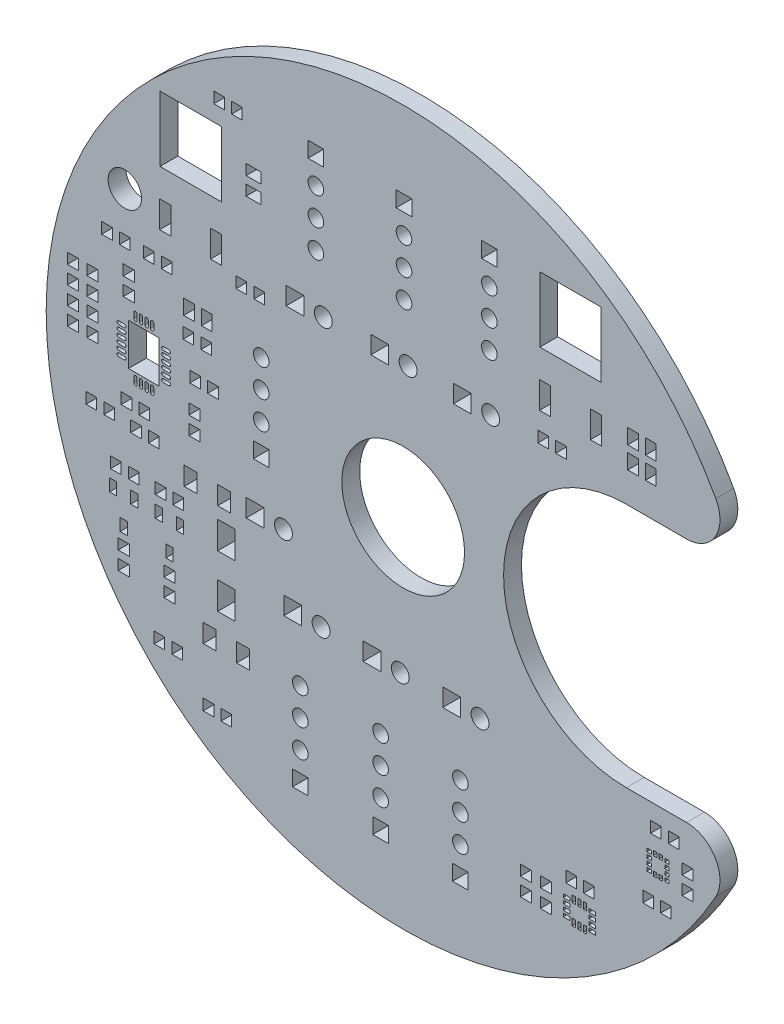
from build123d import *

# Parameters (mm, degrees)
MODEL_R            = 1.5
MODEL_R_2          = 0.7
MODEL_R_3          = 0.8
MODEL_R_4          = 5.500002467
MODEL_W            = 0.4
MODEL_H            = 0.3
MODEL_W_2          = 0.3
MODEL_H_2          = 0.4
MODEL_W_3          = 0.6
MODEL_H_3          = 0.6
MODEL_W_4          = 0.95
MODEL_H_4          = 1.35
MODEL_W_5          = 2.75
MODEL_H_5          = 3.75
MODEL_W_6          = 0.65
MODEL_H_6          = 1.1
MODEL_W_7          = 1.35
MODEL_H_7          = 0.95
MODEL_W_8          = 1
MODEL_H_8          = 2.4
MODEL_W_9          = 5.5
MODEL_H_9          = 5.85
MODEL_H_10         = 1
MODEL_W_10         = 1.15
MODEL_H_11         = 1.65
MODEL_W_11         = 1.55
MODEL_H_12         = 2.45
MODEL_W_12         = 1.4
MODEL_H_13         = 1.4
MODEL_W_13         = 1.6
MODEL_H_14         = 1.6
BOSS_EXTRU_1_DEPTH = 1.6


with BuildPart() as part:
    # Model → Boss.-Extru.1 (new body)
    with BuildSketch(Plane.XY):
        with BuildLine():
            Line((20, 11), (25.3969, 11))
            ThreePointArc((25.3969, 11), (27.979973647, 12.474389155), (28.0241, 15.4483))
            ThreePointArc((28.0241, 15.4483), (-32.000007029, 0), (28.0241, -15.4483))
            ThreePointArc((28.0241, -15.4483), (27.979973647, -12.474389155), (25.3969, -11))
            Line((25.3969, -11), (20, -11))
            ThreePointArc((20, -11), (9, 0), (20, 11))
        make_face()
        with Locations((-24.95, 13)):
            Circle(MODEL_R, mode=Mode.SUBTRACT)
        with Locations((-12.725, 1.025)):
            Circle(MODEL_R_2, mode=Mode.SUBTRACT)
        with Locations((-12.725, 3.525)):
            Circle(MODEL_R_2, mode=Mode.SUBTRACT)
        with Locations((-12.725, 6.025)):
            Circle(MODEL_R_2, mode=Mode.SUBTRACT)
        with Locations((-9.225, -22.7)):
            Circle(MODEL_R_2, mode=Mode.SUBTRACT)
        with Locations((-9.225, -20.2)):
            Circle(MODEL_R_2, mode=Mode.SUBTRACT)
        with Locations((-9.225, -17.7)):
            Circle(MODEL_R_2, mode=Mode.SUBTRACT)
        with Locations((5.125, -22.85)):
            Circle(MODEL_R_2, mode=Mode.SUBTRACT)
        with Locations((5.125, -20.35)):
            Circle(MODEL_R_2, mode=Mode.SUBTRACT)
        with Locations((5.125, -17.85)):
            Circle(MODEL_R_2, mode=Mode.SUBTRACT)
        with Locations((-2.025, -22.8001)):
            Circle(MODEL_R_2, mode=Mode.SUBTRACT)
        with Locations((-2.025, -20.3001)):
            Circle(MODEL_R_2, mode=Mode.SUBTRACT)
        with Locations((-2.025, -17.8001)):
            Circle(MODEL_R_2, mode=Mode.SUBTRACT)
        with Locations((-7.825, 21.7999)):
            Circle(MODEL_R_2, mode=Mode.SUBTRACT)
        with Locations((-7.825, 19.2999)):
            Circle(MODEL_R_2, mode=Mode.SUBTRACT)
        with Locations((-7.825, 16.7999)):
            Circle(MODEL_R_2, mode=Mode.SUBTRACT)
        with Locations((7.725, 21.8)):
            Circle(MODEL_R_2, mode=Mode.SUBTRACT)
        with Locations((7.725, 19.3)):
            Circle(MODEL_R_2, mode=Mode.SUBTRACT)
        with Locations((7.725, 16.8)):
            Circle(MODEL_R_2, mode=Mode.SUBTRACT)
        with Locations((0.075, 21.9)):
            Circle(MODEL_R_2, mode=Mode.SUBTRACT)
        with Locations((0.075, 19.4)):
            Circle(MODEL_R_2, mode=Mode.SUBTRACT)
        with Locations((0.075, 16.9)):
            Circle(MODEL_R_2, mode=Mode.SUBTRACT)
        with Locations((6.89, -12.2)):
            Circle(MODEL_R_3, mode=Mode.SUBTRACT)
        with Locations((-0.26, -12.2)):
            Circle(MODEL_R_3, mode=Mode.SUBTRACT)
        with Locations((-7.36, -12.2)):
            Circle(MODEL_R_3, mode=Mode.SUBTRACT)
        with Locations((-7.16, 11.95)):
            Circle(MODEL_R_3, mode=Mode.SUBTRACT)
        with Locations((0.44, 11.95)):
            Circle(MODEL_R_3, mode=Mode.SUBTRACT)
        with Locations((7.84, 11.85)):
            Circle(MODEL_R_3, mode=Mode.SUBTRACT)
        with Locations((-10.73, -6.3)):
            Circle(MODEL_R_3, mode=Mode.SUBTRACT)
        with Locations((-2.467e-06, 0)):
            Circle(MODEL_R_4, mode=Mode.SUBTRACT)
        with Locations((23.65, -16.4)):
            Rectangle(MODEL_W, MODEL_H, mode=Mode.SUBTRACT)
        with Locations((23.65, -15.9)):
            Rectangle(MODEL_W, MODEL_H, mode=Mode.SUBTRACT)
        with Locations((23.65, -15.4)):
            Rectangle(MODEL_W, MODEL_H, mode=Mode.SUBTRACT)
        with Locations((23.65, -14.9)):
            Rectangle(MODEL_W, MODEL_H, mode=Mode.SUBTRACT)
        with Locations((23.1, -14.85)):
            Rectangle(MODEL_W_2, MODEL_H_2, mode=Mode.SUBTRACT)
        with Locations((22.6, -14.85)):
            Rectangle(MODEL_W_2, MODEL_H_2, mode=Mode.SUBTRACT)
        with Locations((22.05, -14.9)):
            Rectangle(MODEL_W, MODEL_H, mode=Mode.SUBTRACT)
        with Locations((22.05, -15.4)):
            Rectangle(MODEL_W, MODEL_H, mode=Mode.SUBTRACT)
        with Locations((22.05, -15.9)):
            Rectangle(MODEL_W, MODEL_H, mode=Mode.SUBTRACT)
        with Locations((22.05, -16.4)):
            Rectangle(MODEL_W, MODEL_H, mode=Mode.SUBTRACT)
        with Locations((22.6, -16.45)):
            Rectangle(MODEL_W_2, MODEL_H_2, mode=Mode.SUBTRACT)
        with Locations((23.1, -16.45)):
            Rectangle(MODEL_W_2, MODEL_H_2, mode=Mode.SUBTRACT)
        with Locations((16.95, -23.7)):
            Rectangle(MODEL_W_3, MODEL_H, mode=Mode.SUBTRACT)
        with Locations((16.95, -23.2)):
            Rectangle(MODEL_W_3, MODEL_H, mode=Mode.SUBTRACT)
        with Locations((16.95, -22.7)):
            Rectangle(MODEL_W_3, MODEL_H, mode=Mode.SUBTRACT)
        with Locations((16.95, -22.2)):
            Rectangle(MODEL_W_3, MODEL_H, mode=Mode.SUBTRACT)
        with Locations((16.3, -22.05)):
            Rectangle(MODEL_W_2, MODEL_H_3, mode=Mode.SUBTRACT)
        with Locations((15.8, -22.05)):
            Rectangle(MODEL_W_2, MODEL_H_3, mode=Mode.SUBTRACT)
        with Locations((15.3, -22.05)):
            Rectangle(MODEL_W_2, MODEL_H_3, mode=Mode.SUBTRACT)
        with Locations((14.65, -22.2)):
            Rectangle(MODEL_W_3, MODEL_H, mode=Mode.SUBTRACT)
        with Locations((14.65, -22.7)):
            Rectangle(MODEL_W_3, MODEL_H, mode=Mode.SUBTRACT)
        with Locations((14.65, -23.2)):
            Rectangle(MODEL_W_3, MODEL_H, mode=Mode.SUBTRACT)
        with Locations((14.65, -23.7)):
            Rectangle(MODEL_W_3, MODEL_H, mode=Mode.SUBTRACT)
        with Locations((15.3, -23.85)):
            Rectangle(MODEL_W_2, MODEL_H_3, mode=Mode.SUBTRACT)
        with Locations((15.8, -23.85)):
            Rectangle(MODEL_W_2, MODEL_H_3, mode=Mode.SUBTRACT)
        with Locations((16.3, -23.85)):
            Rectangle(MODEL_W_2, MODEL_H_3, mode=Mode.SUBTRACT)
        with Locations((-17.6, 6.5)):
            Rectangle(MODEL_W_4, MODEL_H_4, mode=Mode.SUBTRACT)
        with Locations((-19.2, 6.5)):
            Rectangle(MODEL_W_4, MODEL_H_4, mode=Mode.SUBTRACT)
        with BuildLine():
            Line((-21.5, 0), (-21, 0))
            ThreePointArc((-21, 0), (-20.85, -0.15), (-21, -0.3))
            Line((-21, -0.3), (-21.5, -0.3))
            ThreePointArc((-21.5, -0.3), (-21.65, -0.15), (-21.5, 0))
        make_face(mode=Mode.SUBTRACT)
        with BuildLine():
            Line((-21.5, 0.5), (-21, 0.5))
            ThreePointArc((-21, 0.5), (-20.85, 0.35), (-21, 0.2))
            Line((-21, 0.2), (-21.5, 0.2))
            ThreePointArc((-21.5, 0.2), (-21.65, 0.35), (-21.5, 0.5))
        make_face(mode=Mode.SUBTRACT)
        with BuildLine():
            Line((-21.5, 1), (-21, 1))
            ThreePointArc((-21, 1), (-20.85, 0.85), (-21, 0.7))
            Line((-21, 0.7), (-21.5, 0.7))
            ThreePointArc((-21.5, 0.7), (-21.65, 0.85), (-21.5, 1))
        make_face(mode=Mode.SUBTRACT)
        with BuildLine():
            Line((-21.5, 1.5), (-21, 1.5))
            ThreePointArc((-21, 1.5), (-20.85, 1.35), (-21, 1.2))
            Line((-21, 1.2), (-21.5, 1.2))
            ThreePointArc((-21.5, 1.2), (-21.65, 1.35), (-21.5, 1.5))
        make_face(mode=Mode.SUBTRACT)
        with BuildLine():
            Line((-21.5, 2), (-21, 2))
            ThreePointArc((-21, 2), (-20.85, 1.85), (-21, 1.7))
            Line((-21, 1.7), (-21.5, 1.7))
            ThreePointArc((-21.5, 1.7), (-21.65, 1.85), (-21.5, 2))
        make_face(mode=Mode.SUBTRACT)
        with BuildLine():
            Line((-21.5, 2.5), (-21, 2.5))
            ThreePointArc((-21, 2.5), (-20.85, 2.35), (-21, 2.2))
            Line((-21, 2.2), (-21.5, 2.2))
            ThreePointArc((-21.5, 2.2), (-21.65, 2.35), (-21.5, 2.5))
        make_face(mode=Mode.SUBTRACT)
        with BuildLine():
            Line((-22.65, 3.35), (-22.65, 3.85))
            ThreePointArc((-22.65, 3.85), (-22.5, 4), (-22.35, 3.85))
            Line((-22.35, 3.85), (-22.35, 3.35))
            ThreePointArc((-22.35, 3.35), (-22.5, 3.2), (-22.65, 3.35))
        make_face(mode=Mode.SUBTRACT)
        with BuildLine():
            Line((-23.15, 3.35), (-23.15, 3.85))
            ThreePointArc((-23.15, 3.85), (-23, 4), (-22.85, 3.85))
            Line((-22.85, 3.85), (-22.85, 3.35))
            ThreePointArc((-22.85, 3.35), (-23, 3.2), (-23.15, 3.35))
        make_face(mode=Mode.SUBTRACT)
        with BuildLine():
            Line((-23.65, 3.35), (-23.65, 3.85))
            ThreePointArc((-23.65, 3.85), (-23.5, 4), (-23.35, 3.85))
            Line((-23.35, 3.85), (-23.35, 3.35))
            ThreePointArc((-23.35, 3.35), (-23.5, 3.2), (-23.65, 3.35))
        make_face(mode=Mode.SUBTRACT)
        with BuildLine():
            Line((-24.15, 3.35), (-24.15, 3.85))
            ThreePointArc((-24.15, 3.85), (-24, 4), (-23.85, 3.85))
            Line((-23.85, 3.85), (-23.85, 3.35))
            ThreePointArc((-23.85, 3.35), (-24, 3.2), (-24.15, 3.35))
        make_face(mode=Mode.SUBTRACT)
        with BuildLine():
            Line((-25.5, 2.5), (-25, 2.5))
            ThreePointArc((-25, 2.5), (-24.85, 2.35), (-25, 2.2))
            Line((-25, 2.2), (-25.5, 2.2))
            ThreePointArc((-25.5, 2.2), (-25.65, 2.35), (-25.5, 2.5))
        make_face(mode=Mode.SUBTRACT)
        with BuildLine():
            Line((-25.5, 2), (-25, 2))
            ThreePointArc((-25, 2), (-24.85, 1.85), (-25, 1.7))
            Line((-25, 1.7), (-25.5, 1.7))
            ThreePointArc((-25.5, 1.7), (-25.65, 1.85), (-25.5, 2))
        make_face(mode=Mode.SUBTRACT)
        with BuildLine():
            Line((-25.5, 1.5), (-25, 1.5))
            ThreePointArc((-25, 1.5), (-24.85, 1.35), (-25, 1.2))
            Line((-25, 1.2), (-25.5, 1.2))
            ThreePointArc((-25.5, 1.2), (-25.65, 1.35), (-25.5, 1.5))
        make_face(mode=Mode.SUBTRACT)
        with BuildLine():
            Line((-25.5, 1), (-25, 1))
            ThreePointArc((-25, 1), (-24.85, 0.85), (-25, 0.7))
            Line((-25, 0.7), (-25.5, 0.7))
            ThreePointArc((-25.5, 0.7), (-25.65, 0.85), (-25.5, 1))
        make_face(mode=Mode.SUBTRACT)
        with BuildLine():
            Line((-25.5, 0.5), (-25, 0.5))
            ThreePointArc((-25, 0.5), (-24.85, 0.35), (-25, 0.2))
            Line((-25, 0.2), (-25.5, 0.2))
            ThreePointArc((-25.5, 0.2), (-25.65, 0.35), (-25.5, 0.5))
        make_face(mode=Mode.SUBTRACT)
        with BuildLine():
            Line((-25.5, 0), (-25, 0))
            ThreePointArc((-25, 0), (-24.85, -0.15), (-25, -0.3))
            Line((-25, -0.3), (-25.5, -0.3))
            ThreePointArc((-25.5, -0.3), (-25.65, -0.15), (-25.5, 0))
        make_face(mode=Mode.SUBTRACT)
        with BuildLine():
            Line((-24.15, -1.65), (-24.15, -1.15))
            ThreePointArc((-24.15, -1.15), (-24, -1), (-23.85, -1.15))
            Line((-23.85, -1.15), (-23.85, -1.65))
            ThreePointArc((-23.85, -1.65), (-24, -1.8), (-24.15, -1.65))
        make_face(mode=Mode.SUBTRACT)
        with BuildLine():
            Line((-23.65, -1.65), (-23.65, -1.15))
            ThreePointArc((-23.65, -1.15), (-23.5, -1), (-23.35, -1.15))
            Line((-23.35, -1.15), (-23.35, -1.65))
            ThreePointArc((-23.35, -1.65), (-23.5, -1.8), (-23.65, -1.65))
        make_face(mode=Mode.SUBTRACT)
        with BuildLine():
            Line((-23.15, -1.65), (-23.15, -1.15))
            ThreePointArc((-23.15, -1.15), (-23, -1), (-22.85, -1.15))
            Line((-22.85, -1.15), (-22.85, -1.65))
            ThreePointArc((-22.85, -1.65), (-23, -1.8), (-23.15, -1.65))
        make_face(mode=Mode.SUBTRACT)
        with BuildLine():
            Line((-22.65, -1.65), (-22.65, -1.15))
            ThreePointArc((-22.65, -1.15), (-22.5, -1), (-22.35, -1.15))
            Line((-22.35, -1.15), (-22.35, -1.65))
            ThreePointArc((-22.35, -1.65), (-22.5, -1.8), (-22.65, -1.65))
        make_face(mode=Mode.SUBTRACT)
        with Locations((-23.25, 1.1)):
            Rectangle(MODEL_W_5, MODEL_H_5, mode=Mode.SUBTRACT)
        with Locations((-24.1, -10.65)):
            Rectangle(MODEL_W_6, MODEL_H_6, mode=Mode.SUBTRACT)
        with Locations((-26, -10.65)):
            Rectangle(MODEL_W_6, MODEL_H_6, mode=Mode.SUBTRACT)
        with Locations((-25.05, -13.25)):
            Rectangle(MODEL_W_6, MODEL_H_6, mode=Mode.SUBTRACT)
        with Locations((-20, -10.65)):
            Rectangle(MODEL_W_6, MODEL_H_6, mode=Mode.SUBTRACT)
        with Locations((-21.9, -10.65)):
            Rectangle(MODEL_W_6, MODEL_H_6, mode=Mode.SUBTRACT)
        with Locations((-20.95, -13.25)):
            Rectangle(MODEL_W_6, MODEL_H_6, mode=Mode.SUBTRACT)
        with Locations((22.2, 14.4)):
            Rectangle(MODEL_W_4, MODEL_H_4, mode=Mode.SUBTRACT)
        with Locations((20.6, 14.4)):
            Rectangle(MODEL_W_4, MODEL_H_4, mode=Mode.SUBTRACT)
        with Locations((-13.4, 19.95)):
            Rectangle(MODEL_W_7, MODEL_H_7, mode=Mode.SUBTRACT)
        with Locations((-13.4, 18.35)):
            Rectangle(MODEL_W_7, MODEL_H_7, mode=Mode.SUBTRACT)
        with Locations((20.6, 16.35)):
            Rectangle(MODEL_W_4, MODEL_H_4, mode=Mode.SUBTRACT)
        with Locations((22.2, 16.35)):
            Rectangle(MODEL_W_4, MODEL_H_4, mode=Mode.SUBTRACT)
        with Locations((-21.33, 12.6)):
            Rectangle(MODEL_W_8, MODEL_H_8, mode=Mode.SUBTRACT)
        with Locations((-16.77, 12.6)):
            Rectangle(MODEL_W_8, MODEL_H_8, mode=Mode.SUBTRACT)
        with Locations((-19.05, 19.25)):
            Rectangle(MODEL_W_9, MODEL_H_9, mode=Mode.SUBTRACT)
        with Locations((12.72, 15.6)):
            Rectangle(MODEL_W_8, MODEL_H_8, mode=Mode.SUBTRACT)
        with Locations((17.28, 15.6)):
            Rectangle(MODEL_W_8, MODEL_H_8, mode=Mode.SUBTRACT)
        with Locations((15, 22.25)):
            Rectangle(MODEL_W_9, MODEL_H_9, mode=Mode.SUBTRACT)
        with Locations((-16.5, 24.1)):
            Rectangle(MODEL_W_4, MODEL_H_10, mode=Mode.SUBTRACT)
        with Locations((-14.9, 24.1)):
            Rectangle(MODEL_W_4, MODEL_H_10, mode=Mode.SUBTRACT)
        with Locations((-20.25, -20.5)):
            Rectangle(MODEL_W_4, MODEL_H_10, mode=Mode.SUBTRACT)
        with Locations((-21.85, -20.5)):
            Rectangle(MODEL_W_4, MODEL_H_10, mode=Mode.SUBTRACT)
        with Locations((-17.45, -23.5)):
            Rectangle(MODEL_W_4, MODEL_H_10, mode=Mode.SUBTRACT)
        with Locations((-15.85, -23.5)):
            Rectangle(MODEL_W_4, MODEL_H_10, mode=Mode.SUBTRACT)
        with Locations((-14.5, 10.75)):
            Rectangle(MODEL_W_4, MODEL_H_10, mode=Mode.SUBTRACT)
        with Locations((-12.9, 10.75)):
            Rectangle(MODEL_W_4, MODEL_H_10, mode=Mode.SUBTRACT)
        with Locations((24.25, -12.95)):
            Rectangle(MODEL_W_4, MODEL_H_10, mode=Mode.SUBTRACT)
        with Locations((22.65, -12.95)):
            Rectangle(MODEL_W_4, MODEL_H_10, mode=Mode.SUBTRACT)
        with Locations((23.55, -18.7)):
            Rectangle(MODEL_W_4, MODEL_H_10, mode=Mode.SUBTRACT)
        with Locations((21.95, -18.7)):
            Rectangle(MODEL_W_4, MODEL_H_10, mode=Mode.SUBTRACT)
        with Locations((25.5, -16.4)):
            Rectangle(MODEL_W_8, MODEL_H_7, mode=Mode.SUBTRACT)
        with Locations((25.5, -14.8)):
            Rectangle(MODEL_W_8, MODEL_H_7, mode=Mode.SUBTRACT)
        with Locations((15.05, -20.6)):
            Rectangle(MODEL_W_4, MODEL_H_10, mode=Mode.SUBTRACT)
        with Locations((16.65, -20.6)):
            Rectangle(MODEL_W_4, MODEL_H_10, mode=Mode.SUBTRACT)
        with Locations((11, -23.75)):
            Rectangle(MODEL_W_8, MODEL_H_7, mode=Mode.SUBTRACT)
        with Locations((11, -22.15)):
            Rectangle(MODEL_W_8, MODEL_H_7, mode=Mode.SUBTRACT)
        with Locations((12.8, -23.75)):
            Rectangle(MODEL_W_8, MODEL_H_7, mode=Mode.SUBTRACT)
        with Locations((12.8, -22.15)):
            Rectangle(MODEL_W_8, MODEL_H_7, mode=Mode.SUBTRACT)
        with Locations((-19.25, 4.45)):
            Rectangle(MODEL_W_4, MODEL_H_10, mode=Mode.SUBTRACT)
        with Locations((-17.65, 4.45)):
            Rectangle(MODEL_W_4, MODEL_H_10, mode=Mode.SUBTRACT)
        with Locations((-23.2, -3.4)):
            Rectangle(MODEL_W_4, MODEL_H_10, mode=Mode.SUBTRACT)
        with Locations((-24.8, -3.4)):
            Rectangle(MODEL_W_4, MODEL_H_10, mode=Mode.SUBTRACT)
        with Locations((-26.35, -4.95)):
            Rectangle(MODEL_W_4, MODEL_H_10, mode=Mode.SUBTRACT)
        with Locations((-27.95, -4.95)):
            Rectangle(MODEL_W_4, MODEL_H_10, mode=Mode.SUBTRACT)
        with Locations((-24.6, 6.65)):
            Rectangle(MODEL_W_8, MODEL_H_7, mode=Mode.SUBTRACT)
        with Locations((-24.6, 5.05)):
            Rectangle(MODEL_W_8, MODEL_H_7, mode=Mode.SUBTRACT)
        with Locations((-17.05, 1.35)):
            Rectangle(MODEL_W_4, MODEL_H_10, mode=Mode.SUBTRACT)
        with Locations((-18.65, 1.35)):
            Rectangle(MODEL_W_4, MODEL_H_10, mode=Mode.SUBTRACT)
        with Locations((-18.7, -2.8)):
            Rectangle(MODEL_W_8, MODEL_H_7, mode=Mode.SUBTRACT)
        with Locations((-18.7, -1.2)):
            Rectangle(MODEL_W_8, MODEL_H_7, mode=Mode.SUBTRACT)
        with Locations((-22.35, -5.15)):
            Rectangle(MODEL_W_4, MODEL_H_10, mode=Mode.SUBTRACT)
        with Locations((-23.95, -5.15)):
            Rectangle(MODEL_W_4, MODEL_H_10, mode=Mode.SUBTRACT)
        with Locations((-29.6, 0.25)):
            Rectangle(MODEL_W_8, MODEL_H_7, mode=Mode.SUBTRACT)
        with Locations((-29.6, 1.85)):
            Rectangle(MODEL_W_8, MODEL_H_7, mode=Mode.SUBTRACT)
        with Locations((-27.85, 0.25)):
            Rectangle(MODEL_W_8, MODEL_H_7, mode=Mode.SUBTRACT)
        with Locations((-27.85, 1.85)):
            Rectangle(MODEL_W_8, MODEL_H_7, mode=Mode.SUBTRACT)
        with Locations((-29.6, 3.45)):
            Rectangle(MODEL_W_8, MODEL_H_7, mode=Mode.SUBTRACT)
        with Locations((-29.6, 5.05)):
            Rectangle(MODEL_W_8, MODEL_H_7, mode=Mode.SUBTRACT)
        with Locations((-27.85, 3.45)):
            Rectangle(MODEL_W_8, MODEL_H_7, mode=Mode.SUBTRACT)
        with Locations((-27.85, 5.05)):
            Rectangle(MODEL_W_8, MODEL_H_7, mode=Mode.SUBTRACT)
        with Locations((-22.8, 8.95)):
            Rectangle(MODEL_W_4, MODEL_H_10, mode=Mode.SUBTRACT)
        with Locations((-21.2, 8.95)):
            Rectangle(MODEL_W_4, MODEL_H_10, mode=Mode.SUBTRACT)
        with Locations((-26.55, 8.95)):
            Rectangle(MODEL_W_4, MODEL_H_10, mode=Mode.SUBTRACT)
        with Locations((-24.95, 8.95)):
            Rectangle(MODEL_W_4, MODEL_H_10, mode=Mode.SUBTRACT)
        with Locations((-24.15, -8.85)):
            Rectangle(MODEL_W_4, MODEL_H_10, mode=Mode.SUBTRACT)
        with Locations((-25.75, -8.85)):
            Rectangle(MODEL_W_4, MODEL_H_10, mode=Mode.SUBTRACT)
        with Locations((-25.05, -16.45)):
            Rectangle(MODEL_W_8, MODEL_H_7, mode=Mode.SUBTRACT)
        with Locations((-25.05, -14.85)):
            Rectangle(MODEL_W_8, MODEL_H_7, mode=Mode.SUBTRACT)
        with Locations((-20.15, -8.85)):
            Rectangle(MODEL_W_4, MODEL_H_10, mode=Mode.SUBTRACT)
        with Locations((-21.75, -8.85)):
            Rectangle(MODEL_W_4, MODEL_H_10, mode=Mode.SUBTRACT)
        with Locations((-20.95, -16.5)):
            Rectangle(MODEL_W_8, MODEL_H_7, mode=Mode.SUBTRACT)
        with Locations((-20.95, -14.9)):
            Rectangle(MODEL_W_8, MODEL_H_7, mode=Mode.SUBTRACT)
        with Locations((14.15, 12.3)):
            Rectangle(MODEL_W_4, MODEL_H_10, mode=Mode.SUBTRACT)
        with Locations((12.55, 12.3)):
            Rectangle(MODEL_W_4, MODEL_H_10, mode=Mode.SUBTRACT)
        with Locations((-17.35, -17.95)):
            Rectangle(MODEL_W_10, MODEL_H_11, mode=Mode.SUBTRACT)
        with Locations((-14.35, -17.95)):
            Rectangle(MODEL_W_10, MODEL_H_11, mode=Mode.SUBTRACT)
        with Locations((-19.05, -6.6)):
            Rectangle(MODEL_W_10, MODEL_H_11, mode=Mode.SUBTRACT)
        with Locations((-16.05, -6.6)):
            Rectangle(MODEL_W_10, MODEL_H_11, mode=Mode.SUBTRACT)
        with Locations((-15.85, -9.7)):
            Rectangle(MODEL_W_11, MODEL_H_12, mode=Mode.SUBTRACT)
        with Locations((-15.85, -14.4)):
            Rectangle(MODEL_W_11, MODEL_H_12, mode=Mode.SUBTRACT)
        with Locations((-12.725, -1.475)):
            Rectangle(MODEL_W_12, MODEL_H_13, mode=Mode.SUBTRACT)
        with Locations((-9.225, -25.2)):
            Rectangle(MODEL_W_12, MODEL_H_13, mode=Mode.SUBTRACT)
        with Locations((5.125, -25.35)):
            Rectangle(MODEL_W_12, MODEL_H_13, mode=Mode.SUBTRACT)
        with Locations((-2.025, -25.3001)):
            Rectangle(MODEL_W_12, MODEL_H_13, mode=Mode.SUBTRACT)
        with Locations((-7.825, 24.2999)):
            Rectangle(MODEL_W_12, MODEL_H_13, mode=Mode.SUBTRACT)
        with Locations((7.725, 24.3)):
            Rectangle(MODEL_W_12, MODEL_H_13, mode=Mode.SUBTRACT)
        with Locations((0.075, 24.4)):
            Rectangle(MODEL_W_12, MODEL_H_13, mode=Mode.SUBTRACT)
        with Locations((4.35, -12.2)):
            Rectangle(MODEL_W_13, MODEL_H_14, mode=Mode.SUBTRACT)
        with Locations((-2.8, -12.2)):
            Rectangle(MODEL_W_13, MODEL_H_14, mode=Mode.SUBTRACT)
        with Locations((-9.9, -12.2)):
            Rectangle(MODEL_W_13, MODEL_H_14, mode=Mode.SUBTRACT)
        with Locations((-9.7, 11.95)):
            Rectangle(MODEL_W_13, MODEL_H_14, mode=Mode.SUBTRACT)
        with Locations((-2.1, 11.95)):
            Rectangle(MODEL_W_13, MODEL_H_14, mode=Mode.SUBTRACT)
        with Locations((5.3, 11.85)):
            Rectangle(MODEL_W_13, MODEL_H_14, mode=Mode.SUBTRACT)
        with Locations((-13.27, -6.3)):
            Rectangle(MODEL_W_13, MODEL_H_14, mode=Mode.SUBTRACT)
    extrude(amount=BOSS_EXTRU_1_DEPTH)


solid = part.part
